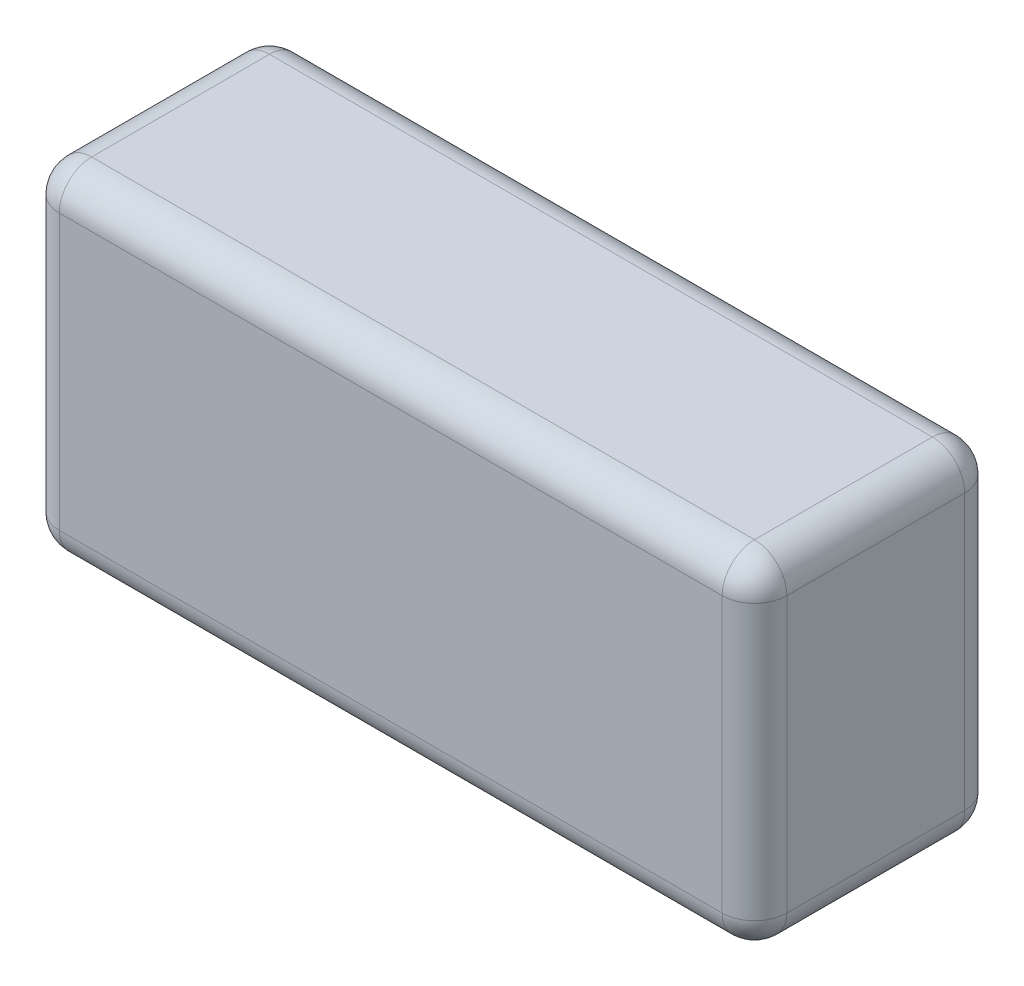
from build123d import *

# Parameters (mm, degrees)
SKETCH1_W           = 75
SKETCH1_H           = 25
BOSS_EXTRUDE1_DEPTH = 35
FILLET1_R           = 3.333333333


with BuildPart() as part:
    # Sketch1 → Boss-Extrude1 (new body)
    with BuildSketch(Plane(origin=(0, 0, 0), x_dir=(1, 0, 0), z_dir=(0, 1, 0))):
        Rectangle(SKETCH1_W, SKETCH1_H)
    extrude(amount=BOSS_EXTRUDE1_DEPTH)

    # Fillet1
    fillet1_edges = [part.edges().sort_by_distance(p)[0] for p in [
        (-37.5, 35, 0),
        (0, 35, 12.5),
        (37.5, 35, 0),
        (0, 0, 12.5),
        (-37.5, 0, 0),
        (0, 0, -12.5),
        (37.5, 0, 0),
        (37.5, 17.5, 12.5),
        (-37.5, 17.5, 12.5),
        (-37.5, 17.5, -12.5),
        (37.5, 17.5, -12.5),
        (0, 35, -12.5),
    ]]
    fillet(fillet1_edges, radius=FILLET1_R)


solid = part.part
